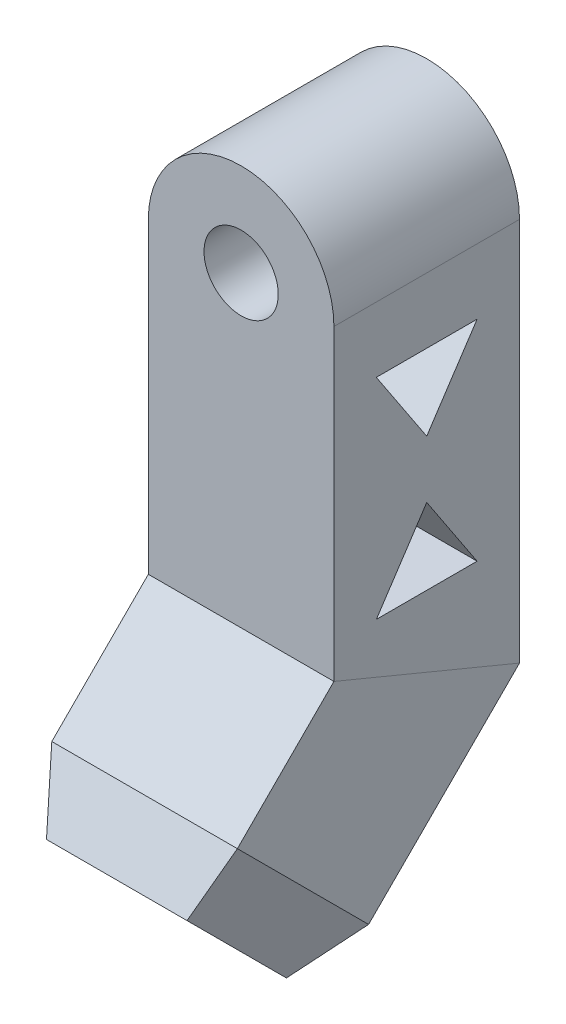
from build123d import *

# Parameters (mm, degrees)
SKETCH11_W          = 38.1
SKETCH11_H          = 38.1
SKETCH12_W          = 38.1
SKETCH12_H          = 38.1
BOSS_EXTRUDE5_DEPTH = 12.7
BOSS_EXTRUDE5_TAPER = 20
BOSS_EXTRUDE6_DEPTH = 38.1
SKETCH14_R          = 7.62
CUT_EXTRUDE2_DEPTH  = 38.1
SKETCH15_R          = 12.065
CUT_EXTRUDE3_DEPTH  = 12.7
CUT_EXTRUDE4_DEPTH  = 38.1


with BuildPart() as part:
    # Sweep1: sweep along a path in Sketch10
    with BuildLine(Plane(origin=(0, 0, 0), x_dir=(0, 0, -1), z_dir=(1, 0, 0))) as sweep1_path:
        Line((0, 96.393), (0, 25.4))
        Line((0, 25.4), (-25.4, 0))
    # Sketch11 → Sweep1 (sweep)
    with BuildSketch(Plane(origin=(0, 96.393, 0), x_dir=(1, 0, 0), z_dir=(0, 1, 0))):
        Rectangle(SKETCH11_W, SKETCH11_H)
    sweep(path=sweep1_path.line, transition=Transition.RIGHT)

    # Sketch12 → Boss-Extrude5 (add)
    with BuildSketch(Plane(origin=(0, -12.7, 12.7), x_dir=(1, 0, 0), z_dir=(0, -0.7071067811865461, 0.7071067811865489))):
        with Locations((0, 17.960512242)):
            Rectangle(SKETCH12_W, SKETCH12_H)
    extrude(amount=BOSS_EXTRUDE5_DEPTH, taper=BOSS_EXTRUDE5_TAPER)

    # Sketch13 → Boss-Extrude6 (add)
    with BuildSketch(Plane(origin=(0, 0, -19.05), x_dir=(-1, 0, 0), z_dir=(0, 0, -1))):
        with BuildLine():
            Line((-19.05, 96.393), (19.05, 96.393))
            ThreePointArc((19.05, 96.393), (0, 115.443), (-19.05, 96.393))
        make_face()
    extrude(amount=-BOSS_EXTRUDE6_DEPTH)

    # Sketch14 → Cut-Extrude2 (cut)
    with BuildSketch(Plane.XY.offset(19.05)):
        with Locations((0, 96.393)):
            Circle(SKETCH14_R)
    extrude(amount=-CUT_EXTRUDE2_DEPTH, mode=Mode.SUBTRACT)

    # Sketch15 → Cut-Extrude3 (cut)
    with BuildSketch(Plane(origin=(0, -21.680256121, 21.680256121), x_dir=(1, 0, 0), z_dir=(0, -0.7071067811865461, 0.7071067811865489))):
        with Locations(Location((0, 17.960512242, 0), (0, 0, 270))):
            Circle(SKETCH15_R)
    extrude(amount=-CUT_EXTRUDE3_DEPTH, mode=Mode.SUBTRACT)

    # Sketch16 → Cut-Extrude4 (cut)
    with BuildSketch(Plane.ZY.offset(19.05)):
        Polygon((-10.345169525, 82.99999799), (10.345169525, 82.99999799), (0, 67.376680748), align=None)
        Polygon((10.345169525, 39.968335079), (0, 55.591652321), (-10.345169525, 39.968335079), align=None)
    extrude(amount=-CUT_EXTRUDE4_DEPTH, mode=Mode.SUBTRACT)


solid = part.part
